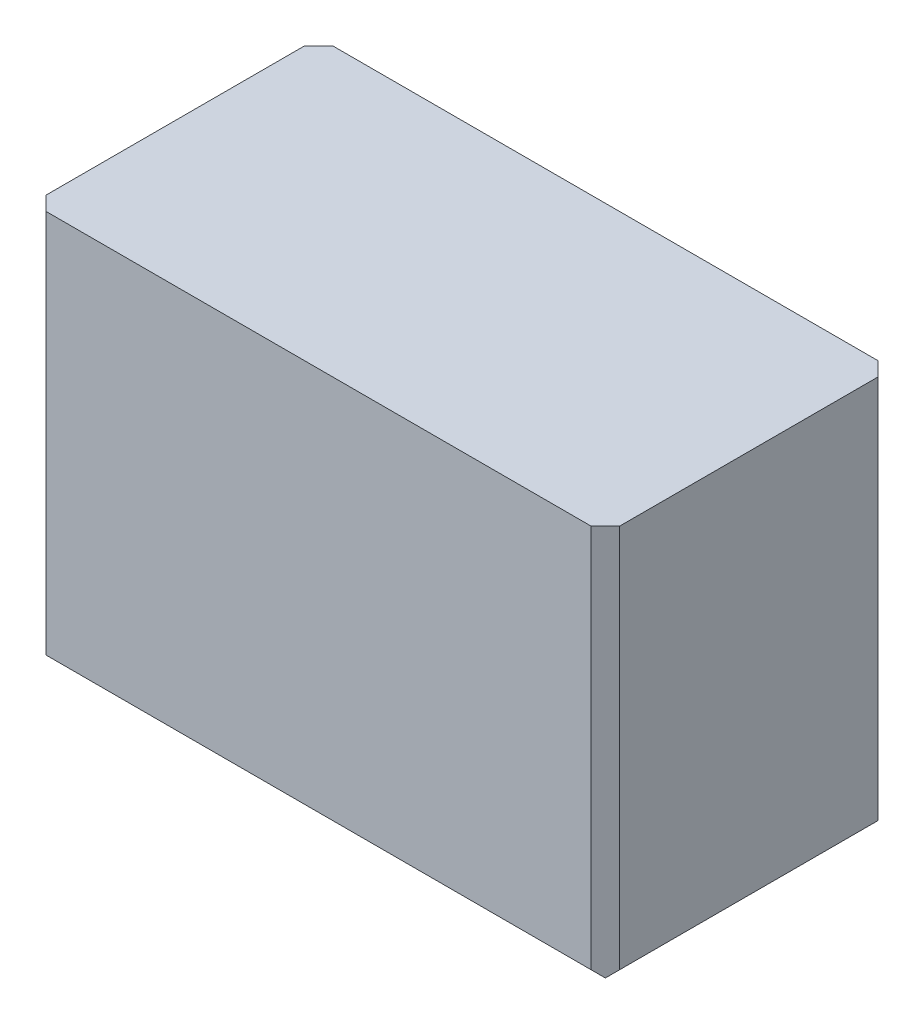
from build123d import *

# Parameters (mm, degrees)
SKETCH_1_W      = 40
SKETCH_1_H      = 27.8
EXTRUDE_1_DEPTH = 20
CHAMFER_1_SIZE  = 1
CHAMFER_2_SIZE  = 1
CHAMFER_3_SIZE  = 1


with BuildPart() as part:
    # 草图1 → 凸台-拉伸1 (new body)
    with BuildSketch(Plane.XY):
        Rectangle(SKETCH_1_W, SKETCH_1_H)
    extrude(amount=EXTRUDE_1_DEPTH)

    # 倒角1
    chamfer_1_edges = [part.edges().sort_by_distance(p)[0] for p in [
        (20, -13.9, 10),
        (-20, -13.9, 10),
    ]]
    chamfer(chamfer_1_edges, length=CHAMFER_1_SIZE)

    # 倒角2
    chamfer_2_edges = [part.edges().sort_by_distance(p)[0] for p in [
        (0, -13.9, 0),
        (0, -13.9, 20),
    ]]
    chamfer(chamfer_2_edges, length=CHAMFER_2_SIZE)

    # 倒角3
    chamfer_3_edges = [part.edges().sort_by_distance(p)[0] for p in [
        (-20, 0.5, 20),
        (20, 0.5, 0),
        (20, 0.5, 20),
        (-20, 0.5, 0),
    ]]
    chamfer(chamfer_3_edges, length=CHAMFER_3_SIZE)


solid = part.part
